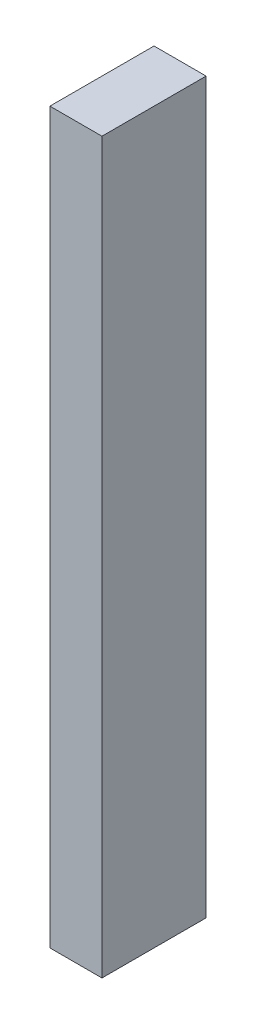
from build123d import *

# Parameters (mm, degrees)
SKETCH1_W           = 19.05
SKETCH1_H           = 266.7
BOSS_EXTRUDE1_DEPTH = 38.1


with BuildPart() as part:
    # Sketch1 → Boss-Extrude1 (new body)
    with BuildSketch(Plane.XY):
        with Locations((-263.525, 0)):
            Rectangle(SKETCH1_W, SKETCH1_H)
    extrude(amount=BOSS_EXTRUDE1_DEPTH)


solid = part.part
